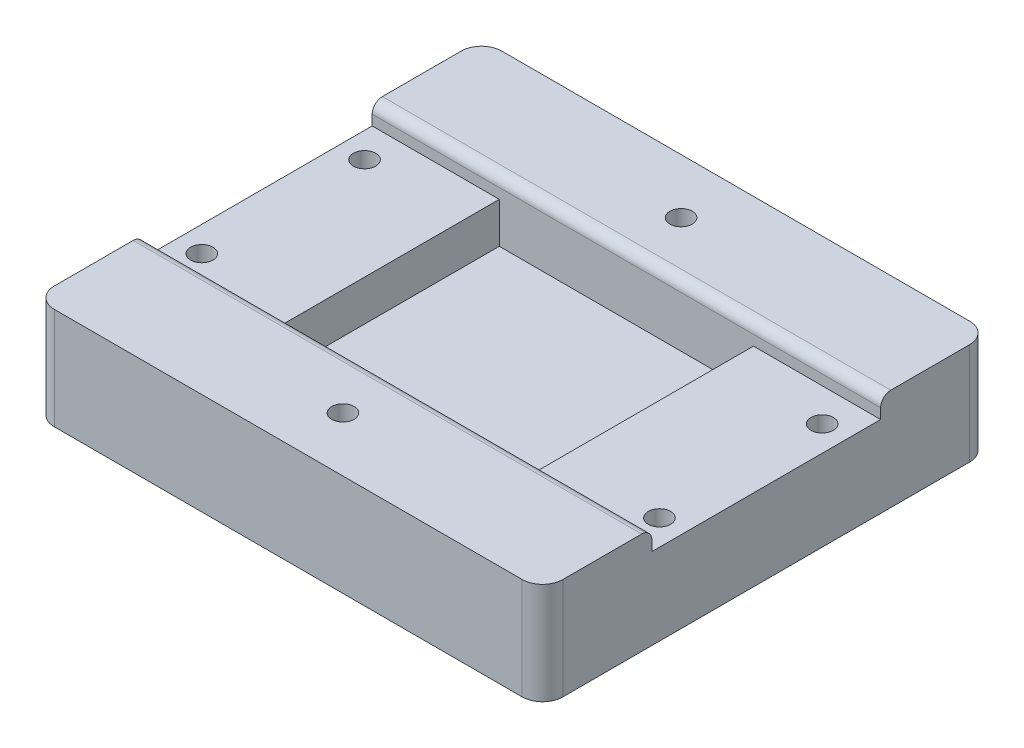
from build123d import *

# Parameters (mm, degrees)
CROQUIS1_W              = 50
CROQUIS1_H              = 44
SALIENTE_EXTRUIR1_DEPTH = 10
CROQUIS2_W              = 58
CROQUIS2_H              = 22.5
CORTAR_EXTRUIR2_DEPTH   = 2
CROQUIS3_W              = 25
CROQUIS3_H              = 22.5
CORTAR_EXTRUIR3_DEPTH   = 4
CROQUIS4_R              = 1.1
CORTAR_EXTRUIR4_DEPTH   = 5
CROQUIS5_R              = 1.1
CORTAR_EXTRUIR5_DEPTH   = 5
REDONDEO1_R             = 2
REDONDEO2_R             = 1


with BuildPart() as part:
    # Croquis1 → Saliente-Extruir1 (new body)
    with BuildSketch(Plane(origin=(0, 0, 0), x_dir=(1, 0, 0), z_dir=(0, 1, 0))):
        Rectangle(CROQUIS1_W, CROQUIS1_H)
    extrude(amount=SALIENTE_EXTRUIR1_DEPTH)

    # Croquis2 → Cortar-Extruir2 (cut)
    with BuildSketch(Plane(origin=(0, 10, 0), x_dir=(1, 0, 0), z_dir=(0, 1, 0))):
        Rectangle(CROQUIS2_W, CROQUIS2_H)
    extrude(amount=-CORTAR_EXTRUIR2_DEPTH, mode=Mode.SUBTRACT)

    # Croquis3 → Cortar-Extruir3 (cut)
    with BuildSketch(Plane(origin=(0, 8, 0), x_dir=(1, 0, 0), z_dir=(0, 1, 0))):
        Rectangle(CROQUIS3_W, CROQUIS3_H)
    extrude(amount=-CORTAR_EXTRUIR3_DEPTH, mode=Mode.SUBTRACT)

    # Croquis4 → Cortar-Extruir4 (cut)
    with BuildSketch(Plane(origin=(0, 8, 0), x_dir=(1, 0, 0), z_dir=(0, 1, 0))):
        with Locations(Location((-22.5, 8, 0), (0, 0, 270))):
            Circle(CROQUIS4_R)
        with Locations(Location((-22.5, -8, 0), (0, 0, 270))):
            Circle(CROQUIS4_R)
        with Locations(Location((22.5, 8, 0), (0, 0, 270))):
            Circle(CROQUIS4_R)
        with Locations(Location((22.5, -8, 0), (0, 0, 270))):
            Circle(CROQUIS4_R)
    extrude(amount=-CORTAR_EXTRUIR4_DEPTH, mode=Mode.SUBTRACT)

    # Croquis5 → Cortar-Extruir5 (cut)
    with BuildSketch(Plane(origin=(0, 10, 0), x_dir=(1, 0, 0), z_dir=(0, 1, 0))):
        with Locations(Location((0, 16.625, 0), (0, 0, 270))):
            Circle(CROQUIS5_R)
        with Locations(Location((0, -16.625, 0), (0, 0, 270))):
            Circle(CROQUIS5_R)
    extrude(amount=-CORTAR_EXTRUIR5_DEPTH, mode=Mode.SUBTRACT)

    # Redondeo1
    redondeo1_edges = [part.edges().sort_by_distance(p)[0] for p in [
        (-25, 5, -22),
        (25, 5, -22),
        (25, 5, 22),
        (-25, 5, 22),
    ]]
    fillet(redondeo1_edges, radius=REDONDEO1_R)

    # Redondeo2
    redondeo2_edges = [part.edges().sort_by_distance(p)[0] for p in [
        (0, 10, 11.25),
        (0, 10, -11.25),
    ]]
    fillet(redondeo2_edges, radius=REDONDEO2_R)


solid = part.part
